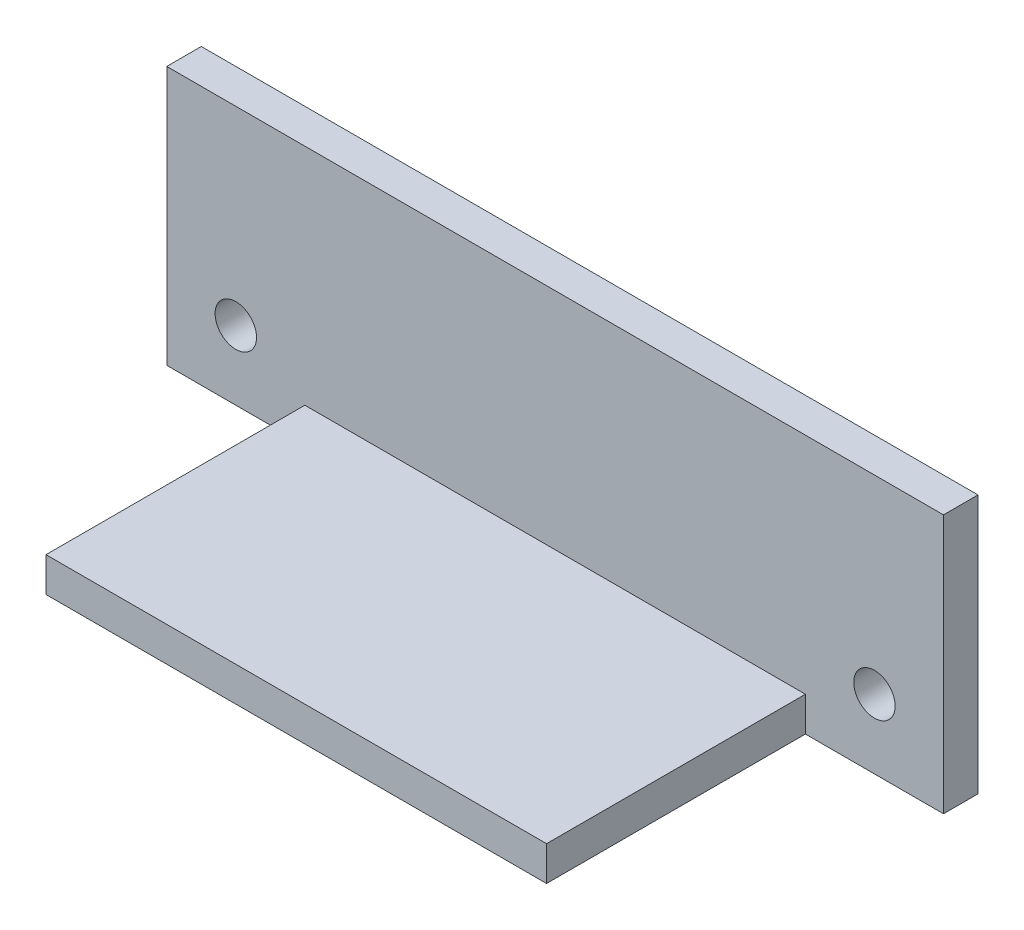
from build123d import *

# Parameters (mm, degrees)
SKETCH2_W            = 29
SKETCH2_H            = 15.11
BOSS_EXTRUDE1_DEPTH  = 2
SKETCH7_W            = 45
SKETCH7_H            = 2
BOSS_EXTRUDE2_DEPTH  = 15
M2_CLEARANCE_HOLE1_D = 2.4
M2_CLEARANCE_HOLE2_D = 2.4


with BuildPart() as part:
    # Sketch2 → Boss-Extrude1 (new body)
    with BuildSketch(Plane(origin=(0, 0, 0), x_dir=(1, 0, 0), z_dir=(0, 1, 0))):
        with Locations((-24.397211382, -7.555)):
            Rectangle(SKETCH2_W, SKETCH2_H)
    extrude(amount=BOSS_EXTRUDE1_DEPTH)

    # Sketch7 → Boss-Extrude2 (add)
    with BuildSketch(Plane(origin=(0, 0, 0), x_dir=(-1, 0, 0), z_dir=(0, -1, 0))):
        with Locations((24.397211382, 0.886680676)):
            Rectangle(SKETCH7_W, SKETCH7_H)
    extrude(amount=-BOSS_EXTRUDE2_DEPTH)

    # M2 Clearance Hole1 (through all)
    with Locations(Plane.XY.offset(0.113319324)):
        with Locations((-42.897211382, 4)):
            Hole(M2_CLEARANCE_HOLE1_D / 2)

    # M2 Clearance Hole2 (through all)
    with Locations(Plane.XY.offset(0.113319324)):
        with Locations((-5.897211382, 4)):
            Hole(M2_CLEARANCE_HOLE2_D / 2)


solid = part.part
